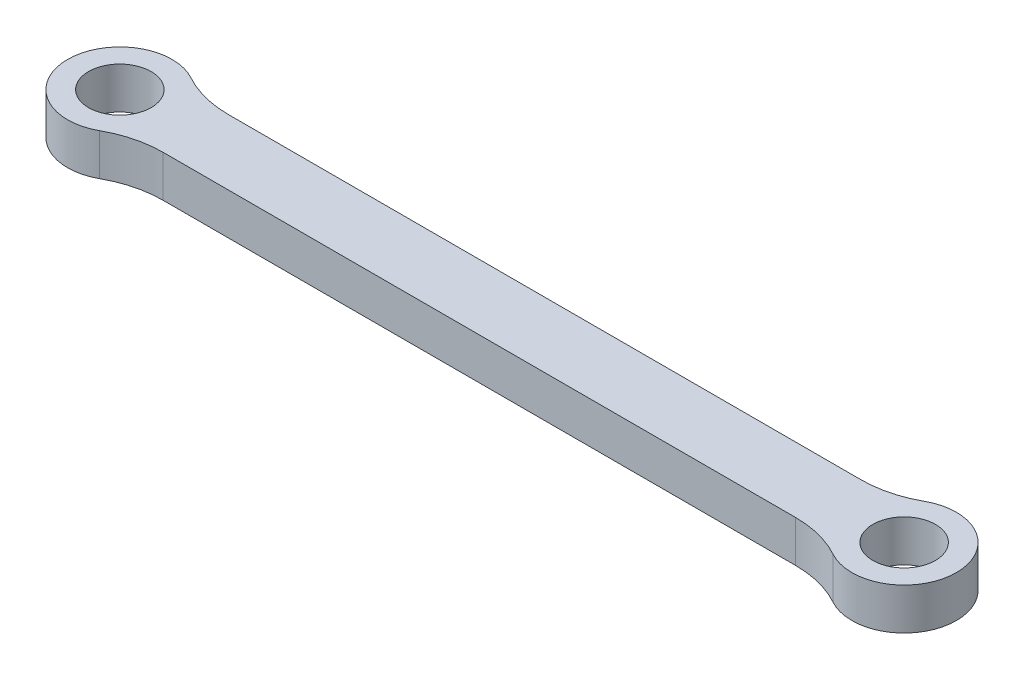
from build123d import *

# Parameters (mm, degrees)
SKETCH_1_W          = 60
SKETCH_1_H          = 5
EXTRUDE_1_DEPTH     = 3.18
SKETCH_2_R          = 4
EXTRUDE_2_DEPTH     = 3.18
SKETCH_3_R          = 2.395
CUT_EXTRUDE_1_DEPTH = 3.18
FILLET_3_R          = 8
FILLET_4_R          = 8
FILLET_5_R          = 8


with BuildPart() as part:
    # 草图1 → 凸台-拉伸1 (new body)
    with BuildSketch(Plane(origin=(0, 0, 0), x_dir=(1, 0, 0), z_dir=(0, 1, 0))):
        Rectangle(SKETCH_1_W, SKETCH_1_H)
    extrude(amount=EXTRUDE_1_DEPTH)

    # 草图2 → 凸台-拉伸2 (add)
    with BuildSketch(Plane(origin=(0, 0, 0), x_dir=(1, 0, 0), z_dir=(0, 1, 0))):
        with Locations((30, 0)):
            Circle(SKETCH_2_R)
        with Locations((-30, 0)):
            Circle(SKETCH_2_R)
    extrude(amount=EXTRUDE_2_DEPTH)

    # 草图3 → 切除-拉伸1 (cut)
    with BuildSketch(Plane(origin=(0, 0, 0), x_dir=(1, 0, 0), z_dir=(0, 1, 0))):
        with Locations(Location((30, 0, 0), (0, 0, 270))):
            Circle(SKETCH_3_R)
        with Locations(Location((-30, 0, 0), (0, 0, 270))):
            Circle(SKETCH_3_R)
    extrude(amount=CUT_EXTRUDE_1_DEPTH, mode=Mode.SUBTRACT)

    # 圆角3
    fillet_3_edges = [part.edges().sort_by_distance(p)[0] for p in [
        (-26.877501001, 1.59, -2.5),
    ]]
    fillet(fillet_3_edges, radius=FILLET_3_R)

    # 圆角4
    fillet_4_edges = [part.edges().sort_by_distance(p)[0] for p in [
        (-26.877501001, 1.59, 2.5),
    ]]
    fillet(fillet_4_edges, radius=FILLET_4_R)

    # 圆角5
    fillet_5_edges = [part.edges().sort_by_distance(p)[0] for p in [
        (26.877501001, 1.59, -2.5),
        (26.877501001, 1.59, 2.5),
    ]]
    fillet(fillet_5_edges, radius=FILLET_5_R)


solid = part.part
